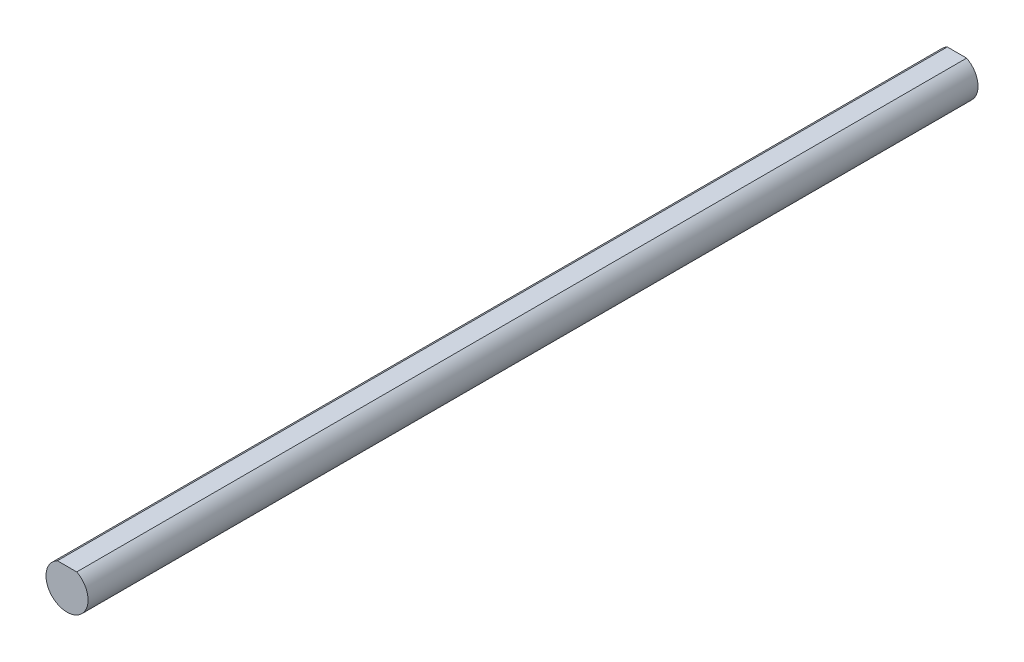
from build123d import *

# Parameters (mm, degrees)
EXTRUDE1_DEPTH = 50


with BuildPart() as part:
    # Sketch1 → Extrude1 (new, symmetric)
    with BuildSketch(Plane.XY):
        with BuildLine():
            Line((-1.087761463, 2.1), (1.087761463, 2.1))
            ThreePointArc((1.087761463, 2.1), (0, -2.365), (-1.087761463, 2.1))
        make_face()
    extrude(amount=EXTRUDE1_DEPTH, both=True)


solid = part.part
